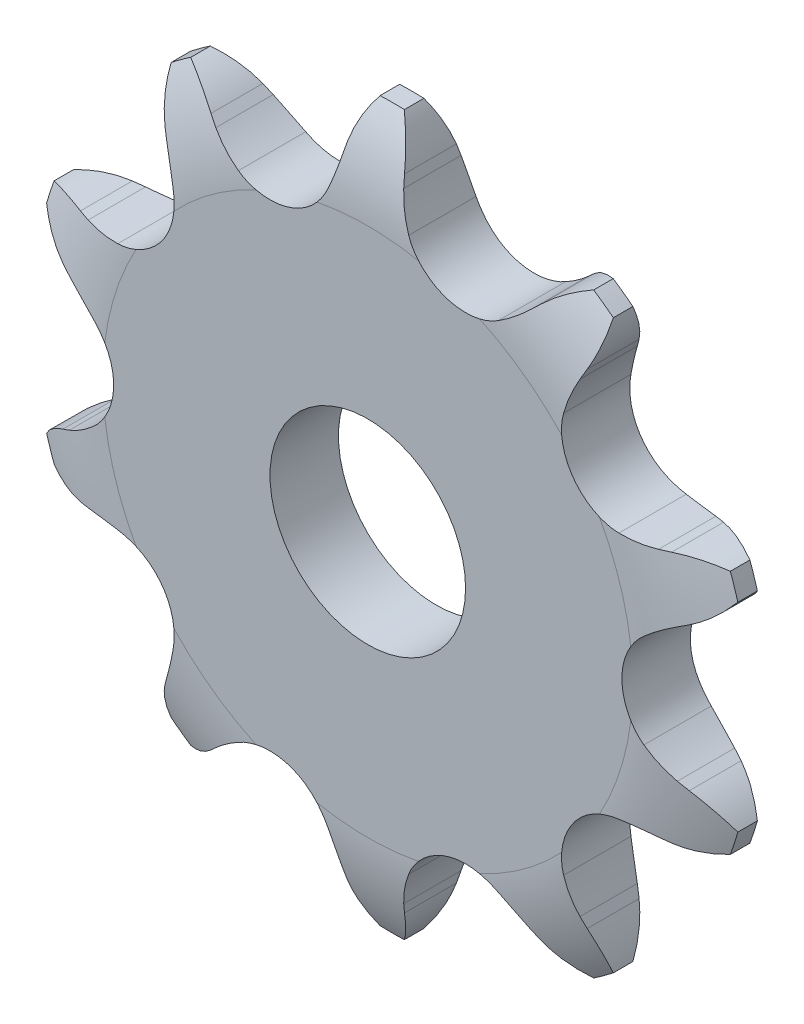
from build123d import *

# Parameters (mm, degrees)
CUT_EXTRUDE1_DEPTH      = 21.85117259
CIRPATTERN1_COUNT       = 10
BOSS_EXTRUDE1_START     = 1.4
SKETCH2_R               = 8.5
BOSS_EXTRUDE1_DEPTH     = 9.2
CUT_EXTRUDE2_DEPTH      = 23.991346491
CUT_EXTRUDE2_DEPTH_BACK = 23.991346491
SKETCH3_R               = 4
SKETCH4_W               = 2.1
SKETCH4_H               = 7.066462239
SKETCH6_R               = 9
CUT_EXTRUDE4_DEPTH      = 10


with BuildPart() as part:
    # Sketch1 → Revolve1 (revolve)
    with BuildSketch(Plane(origin=(0, 0, 0), x_dir=(0, 0, -1), z_dir=(1, 0, 0))):
        with BuildLine():
            Line((1.4, 0), (-1.4, 0))
            Line((-1.4, 0), (-1.4, 10.837750802))
            ThreePointArc((-1.4, 10.837750802), (-1.145966692, 12.837750802), (-0.4, 14.710734149))
            Line((-0.4, 14.710734149), (0.4, 14.710734149))
            ThreePointArc((0.4, 14.710734149), (1.145966692, 12.837750802), (1.4, 10.837750802))
            Line((1.4, 10.837750802), (1.4, 0))
        make_face()
    revolve(axis=Axis((0, 0, -1.4), (0, 0, 1)))

    # Sketch0 → Cut-Extrude1 (cut, symmetric)
    with BuildSketch(Plane.XY):
        with BuildLine():
            Line((6.752178894, -11.274470195), (6.440683149, -10.979903312))
            ThreePointArc((6.440683149, -10.979903312), (5.900334662, -10.521654471), (5.313656114, -10.124443232))
            ThreePointArc((5.313656114, -10.124443232), (3.211821254, -9.884969398), (1.652160321, -11.314135332))
            ThreePointArc((1.652160321, -11.314135332), (1.411002313, -11.980326974), (1.243203116, -12.668666945))
            Line((1.243203116, -12.668666945), (1.164339834, -13.090069165))
            ThreePointArc((1.164339834, -13.090069165), (-0.701731337, -15.869814152), (-4.003070971, -16.426914167))
            ThreePointArc((-4.003070971, -16.426914167), (5.22474623, -16.080115457), (12.894050334, -10.936706646))
            ThreePointArc((12.894050334, -10.936706646), (9.895755292, -12.426482016), (6.752178894, -11.274470195))
        make_face()
    cut_extrude1 = extrude(amount=CUT_EXTRUDE1_DEPTH, both=True, mode=Mode.SUBTRACT)

    # CirPattern1: Cut-Extrude1 ×10 about axis
    cirpattern1_axis = Axis((0, 0, 0), (0, 0, 1))
    for i in range(1, CIRPATTERN1_COUNT):
        add(cut_extrude1.rotate(cirpattern1_axis, i * 360 / CIRPATTERN1_COUNT), mode=Mode.SUBTRACT)

    # Sketch2 → Boss-Extrude1 (add)
    with BuildSketch(Plane.XY.offset(BOSS_EXTRUDE1_START)):
        with Locations(Location((0, 0, 0), (0, 0, 270))):
            Circle(SKETCH2_R)
    extrude(amount=BOSS_EXTRUDE1_DEPTH)

    # Sketch3 → Cut-Extrude2 (cut, two sides: drawn at the far end of the back side and taken through both)
    with BuildSketch(Plane.XY.offset(-CUT_EXTRUDE2_DEPTH_BACK)):
        Circle(SKETCH3_R)
    extrude(amount=CUT_EXTRUDE2_DEPTH + CUT_EXTRUDE2_DEPTH_BACK, mode=Mode.SUBTRACT)

    # Sketch4 → Cut-Revolve1 (revolve, cut)
    with BuildSketch(Plane(origin=(0, 0, 0), x_dir=(0, 0, -1), z_dir=(1, 0, 0))):
        Polygon((-10.6, 8.5), (-10.6, 8), (-10.1, 8.5), align=None)
        with Locations((-2.45, 11.17750303)):
            Rectangle(SKETCH4_W, SKETCH4_H)
    revolve(axis=Axis((0, 0, -1.4), (0, 0, 1)), mode=Mode.SUBTRACT)

    # Sketch6 → Cut-Extrude4 (cut)
    with BuildSketch(Plane.XY.offset(1.4)):
        Circle(SKETCH6_R)
    extrude(amount=CUT_EXTRUDE4_DEPTH, mode=Mode.SUBTRACT)


solid = part.part
